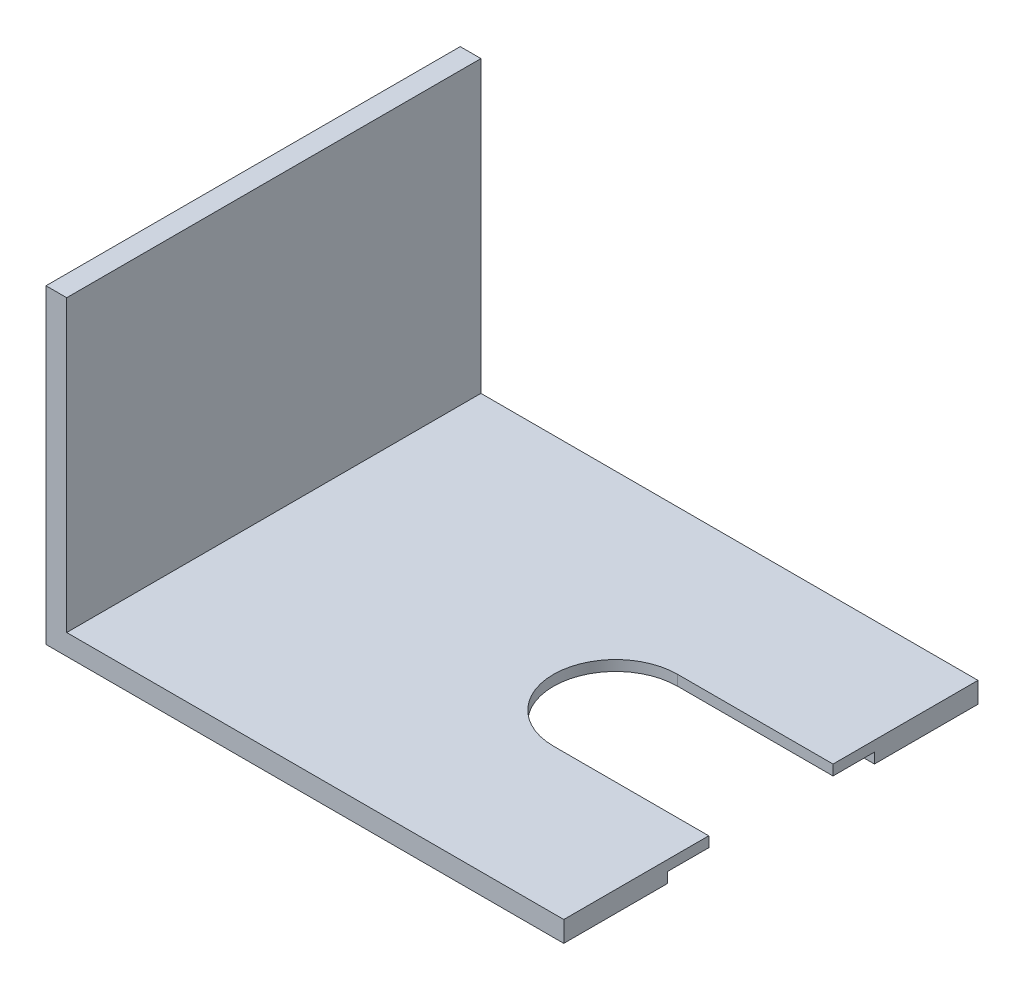
from build123d import *

# Parameters (mm, degrees)
BOSS_EXTRUDE1_DEPTH = 40
SKETCH4_R           = 6
CUT_EXTRUDE1_DEPTH  = 71.710678119
CUT_EXTRUDE2_DEPTH  = 1


with BuildPart() as part:
    # Sketch1 → Boss-Extrude1 (new body)
    with BuildSketch(Plane.XY):
        Polygon((0, 0), (0, 30), (2, 30), (2, 2), (50, 2), (50, 0), align=None)
    extrude(amount=BOSS_EXTRUDE1_DEPTH)

    # Sketch4 → Cut-Extrude1 (cut, through all)
    with BuildSketch(Plane(origin=(0, 0, 0), x_dir=(-1, 0, 0), z_dir=(0, -1, 0))):
        with BuildLine():
            Line((-50, -26), (-35, -26))
            ThreePointArc((-35, -26), (-41, -20), (-35, -14))
            Line((-35, -14), (-50, -14))
            Line((-50, -14), (-50, -26))
        make_face()
        with Locations((-35, -20)):
            Circle(SKETCH4_R)
    extrude(amount=-CUT_EXTRUDE1_DEPTH, mode=Mode.SUBTRACT)

    # Sketch5 → Cut-Extrude2 (cut)
    with BuildSketch(Plane(origin=(0, 0, 0), x_dir=(-1, 0, 0), z_dir=(0, -1, 0))):
        with BuildLine():
            Line((-50, -30), (-35, -30))
            ThreePointArc((-35, -30), (-39.472135955, -28.94427191), (-43, -26))
            Line((-43, -26), (-50, -26))
            Line((-50, -26), (-50, -30))
        make_face()
        with BuildLine():
            Line((-50, -14), (-43, -14))
            ThreePointArc((-43, -14), (-39.876214832, -11.269448533), (-35.913040721, -10.041769402))
            Line((-35.913040721, -10.041769402), (-50, -10))
            Line((-50, -10), (-50, -14))
        make_face()
        with BuildLine():
            ThreePointArc((-43, -26), (-39.472135955, -28.94427191), (-35, -30))
            ThreePointArc((-35, -30), (-27.928932188, -27.071067812), (-25, -20))
            ThreePointArc((-25, -20), (-27.593219771, -13.281398461), (-34.027921329, -10.047358991))
            Line((-34.027921329, -10.047358991), (-35.913040721, -10.041769402))
            ThreePointArc((-35.913040721, -10.041769402), (-39.876214832, -11.269448533), (-43, -14))
            Line((-43, -14), (-35, -14))
            ThreePointArc((-35, -14), (-29, -20), (-35, -26))
            Line((-35, -26), (-43, -26))
        make_face()
    extrude(amount=-CUT_EXTRUDE2_DEPTH, mode=Mode.SUBTRACT)


solid = part.part
